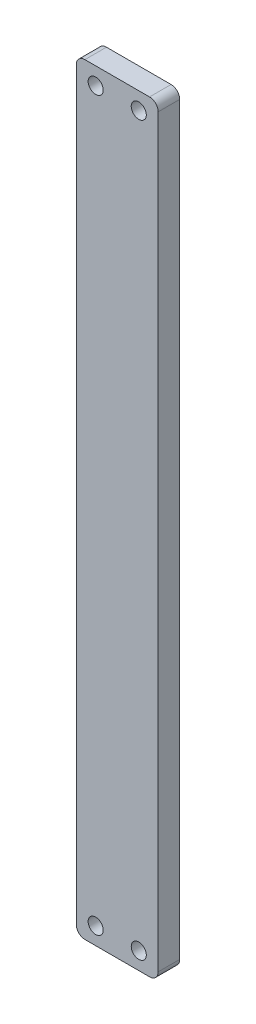
from build123d import *

# Parameters (mm, degrees)
SKETCH1_R           = 1.75
BOSS_EXTRUDE1_DEPTH = 5


with BuildPart() as part:
    # Sketch1 → Boss-Extrude1 (new body)
    with BuildSketch(Plane.XY):
        with BuildLine():
            Line((-9.5, -179.270297721), (-9.5, -6.429702279))
            ThreePointArc((-9.5, -6.429702279), (-8.914213562, -5.015488716), (-7.5, -4.429702279))
            Line((-7.5, -4.429702279), (7.5, -4.429702279))
            ThreePointArc((7.5, -4.429702279), (8.914213562, -5.015488716), (9.5, -6.429702279))
            Line((9.5, -6.429702279), (9.5, -179.270297721))
            ThreePointArc((9.5, -179.270297721), (8.914213562, -180.684511284), (7.5, -181.270297721))
            Line((7.5, -181.270297721), (-7.5, -181.270297721))
            ThreePointArc((-7.5, -181.270297721), (-8.914213562, -180.684511284), (-9.5, -179.270297721))
        make_face()
        with Locations((5, -8.429702279)):
            Circle(SKETCH1_R, mode=Mode.SUBTRACT)
        with Locations((-5, -8.429702279)):
            Circle(SKETCH1_R, mode=Mode.SUBTRACT)
        with Locations(Location((-5, -177.270297721, 0), (0, 0, 180))):
            Circle(SKETCH1_R, mode=Mode.SUBTRACT)
        with Locations(Location((5, -177.270297721, 0), (0, 0, 180))):
            Circle(SKETCH1_R, mode=Mode.SUBTRACT)
    extrude(amount=BOSS_EXTRUDE1_DEPTH)


solid = part.part
